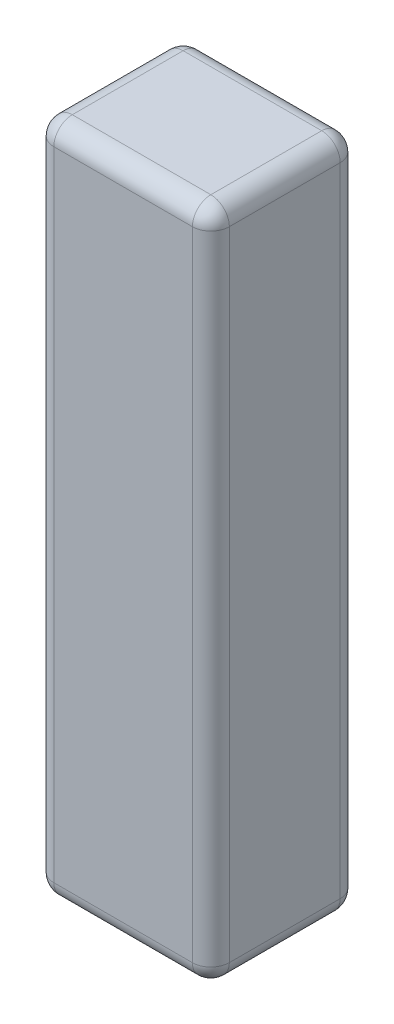
from build123d import *

# Parameters (mm, degrees)
SKETCH1_W           = 19
SKETCH1_H           = 16
BOSS_EXTRUDE1_DEPTH = 73
FILLET1_R           = 2


with BuildPart() as part:
    # Sketch1 → Boss-Extrude1 (new body)
    with BuildSketch(Plane(origin=(0, 0, 0), x_dir=(1, 0, 0), z_dir=(0, 1, 0))):
        Rectangle(SKETCH1_W, SKETCH1_H)
    extrude(amount=BOSS_EXTRUDE1_DEPTH)

    # Fillet1
    fillet1_edges = [part.edges().sort_by_distance(p)[0] for p in [
        (-9.5, 73, 0),
        (0, 73, 8),
        (9.5, 73, 0),
        (0, 0, 8),
        (-9.5, 0, 0),
        (0, 0, -8),
        (9.5, 0, 0),
        (9.5, 36.5, 8),
        (-9.5, 36.5, 8),
        (-9.5, 36.5, -8),
        (9.5, 36.5, -8),
        (0, 73, -8),
    ]]
    fillet(fillet1_edges, radius=FILLET1_R)


solid = part.part
